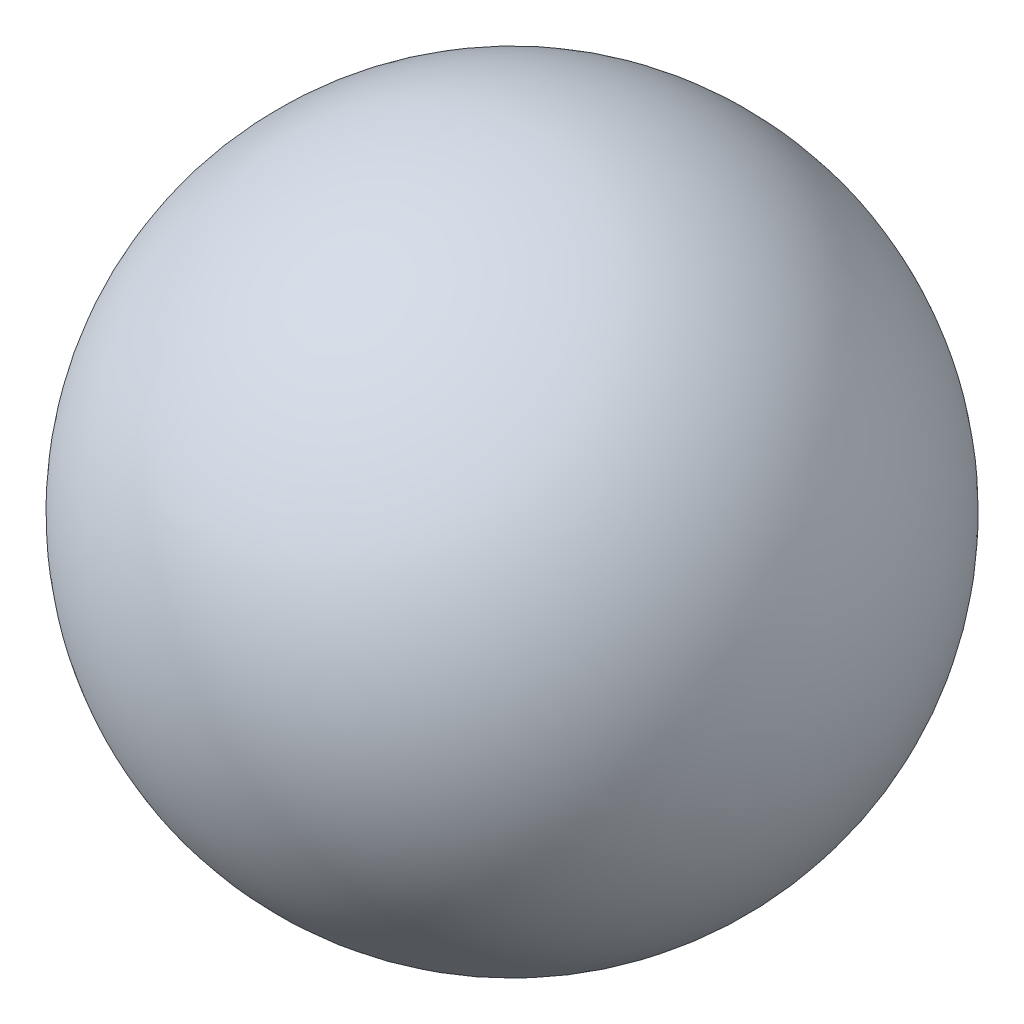
from build123d import *


with BuildPart() as part:
    # Sketch1 → Revolve5 (revolve)
    with BuildSketch(Plane(origin=(0, 0, 0), x_dir=(1, 0, 0), z_dir=(0, 1, 0))):
        with BuildLine():
            Line((0, -2.25), (0, 2.25))
            ThreePointArc((0, 2.25), (2.25, 0), (0, -2.25))
        make_face()
    revolve(axis=Axis((0, 0, 2.25), (0, 0, -1)))


solid = part.part
